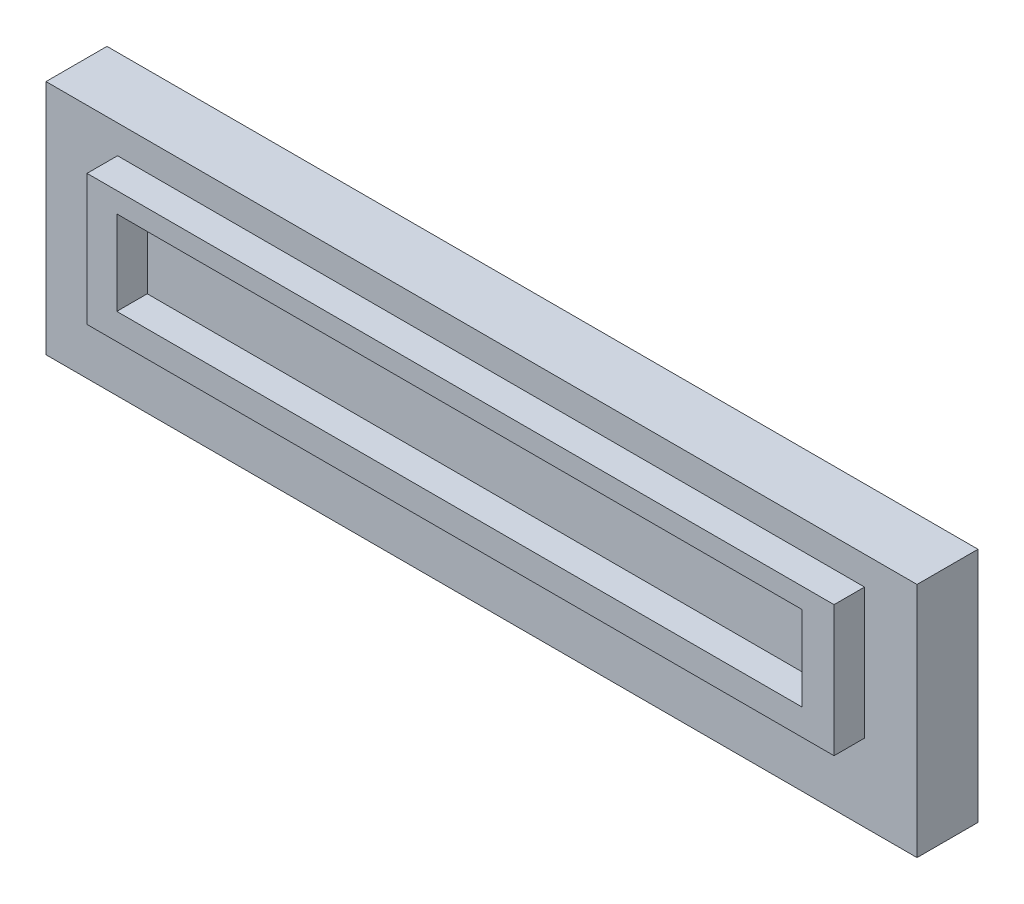
from build123d import *

# Parameters (mm, degrees)
SKETCH1_W           = 142.854484363
SKETCH1_H           = 38.804222916
BOSS_EXTRUDE1_DEPTH = 10
SKETCH2_W           = 122.513841523
SKETCH2_H           = 21.45943084
SKETCH2_W_2         = 112.369383308
SKETCH2_H_2         = 13.851087179
BOSS_EXTRUDE2_DEPTH = 5


with BuildPart() as part:
    # Sketch1 → Boss-Extrude1 (new body)
    with BuildSketch(Plane.XY):
        with Locations((-14.079408315, 1.030200608)):
            Rectangle(SKETCH1_W, SKETCH1_H)
    extrude(amount=BOSS_EXTRUDE1_DEPTH)

    # Sketch2 → Boss-Extrude2 (add)
    with BuildSketch(Plane.XY.offset(10)):
        with Locations((-12.518722436, 5.029458174)):
            Rectangle(SKETCH2_W, SKETCH2_H)
        with Locations((-12.71380817, 5.517172512)):
            Rectangle(SKETCH2_W_2, SKETCH2_H_2, mode=Mode.SUBTRACT)
    extrude(amount=BOSS_EXTRUDE2_DEPTH)


solid = part.part
